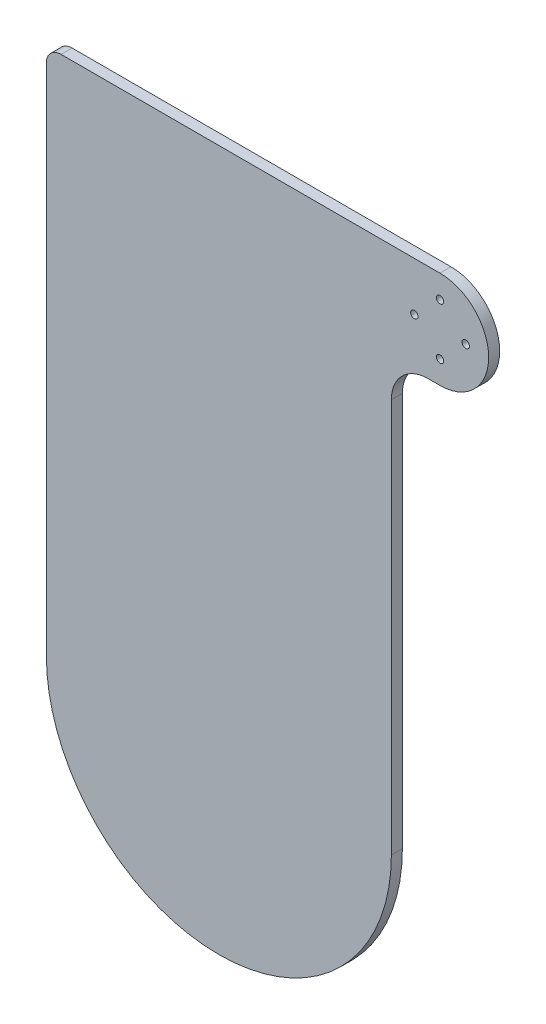
from build123d import *

# Parameters (mm, degrees)
EXTRUDE_1_DEPTH     = 3
SKETCH_2_R          = 1
CUT_EXTRUDE_1_DEPTH = 10
FILLET_1_R          = 4


with BuildPart() as part:
    # 草图1 → 凸台-拉伸1 (new body)
    with BuildSketch(Plane.XY):
        with BuildLine():
            Line((-60.568770688, -43.609385344), (-60.568770688, 100.290614656))
            Line((-60.568770688, 100.290614656), (33.431229312, 100.290614656))
            Line((33.431229312, 100.290614656), (46.681229312, 100.290614656))
            ThreePointArc((46.681229312, 100.290614656), (59.931229312, 87.040614656), (46.681229312, 73.790614656))
            Line((46.681229312, 73.790614656), (43.431229312, 73.790614656))
            ThreePointArc((43.431229312, 73.790614656), (36.3601615, 70.861682468), (33.431229312, 63.790614656))
            Line((33.431229312, 63.790614656), (33.431229312, -43.609385344))
            ThreePointArc((33.431229312, -43.609385344), (-13.568770688, -90.609385344), (-60.568770688, -43.609385344))
        make_face()
    extrude(amount=EXTRUDE_1_DEPTH)

    # 草图2 → 切除-拉伸1 (cut)
    with BuildSketch(Plane(origin=(0, 0, 0), x_dir=(-1, 0, 0), z_dir=(0, 0, -1))):
        with Locations((-46.681229312, 94.040614656)):
            Circle(SKETCH_2_R)
        with Locations((-39.681229312, 87.040614656)):
            Circle(SKETCH_2_R)
        with Locations((-46.681229312, 80.040614656)):
            Circle(SKETCH_2_R)
        with Locations((-53.681229312, 87.040614656)):
            Circle(SKETCH_2_R)
    extrude(amount=-CUT_EXTRUDE_1_DEPTH, mode=Mode.SUBTRACT)

    # 圆角1
    fillet_1_edges = [part.edges().sort_by_distance(p)[0] for p in [
        (-60.568770688, 100.290614656, 1.5),
    ]]
    fillet(fillet_1_edges, radius=FILLET_1_R)


solid = part.part
